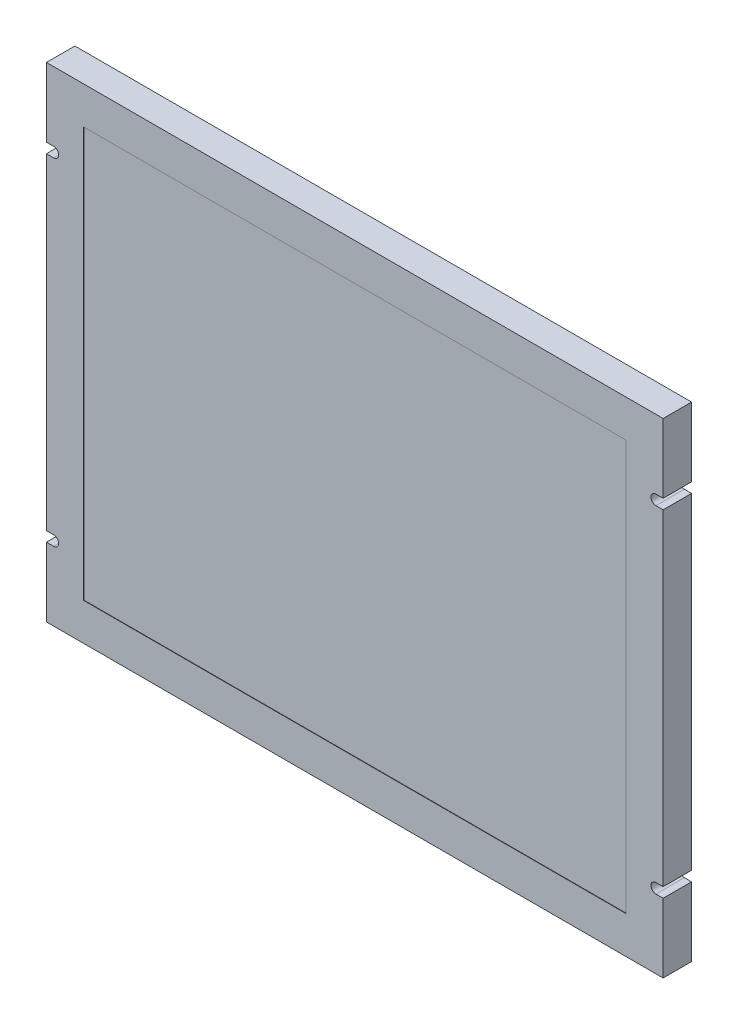
from build123d import *

# Parameters (mm, degrees)
SKETCH1_W            = 154
SKETCH1_H            = 121
EXTRUDE1_DEPTH       = 7.1
SKETCH2_W            = 135.5
SKETCH2_H            = 102.4
BEZEL_OPENING_DEPTH  = 0.1
CUT_EXTRUDE3_DEPTH   = 10
LPATTERN1_COUNT      = 2
LPATTERN1_PITCH      = 84
LPATTERN1_COUNT_DIR2 = 2
LPATTERN1_PITCH_DIR2 = 152.2


with BuildPart() as part:
    # Sketch1 → Extrude1 (new body)
    with BuildSketch(Plane.XY):
        with Locations((77, -60.5)):
            Rectangle(SKETCH1_W, SKETCH1_H)
    extrude(amount=EXTRUDE1_DEPTH)

    # Sketch2 → Bezel Opening (cut)
    with BuildSketch(Plane.XY.offset(7.1)):
        with Locations((77, -60.5)):
            Rectangle(SKETCH2_W, SKETCH2_H)
    extrude(amount=-BEZEL_OPENING_DEPTH, mode=Mode.SUBTRACT)

    # Sketch3 → Cut-Extrude3 (cut)
    with BuildSketch(Plane.XY.offset(7.1)):
        with BuildLine():
            Line((154, -17.25), (152.2, -17.25))
            ThreePointArc((152.2, -17.25), (150.95, -18.5), (152.2, -19.75))
            Line((152.2, -19.75), (154, -19.75))
            ThreePointArc((154, -19.75), (155.25, -18.5), (154, -17.25))
        make_face()
    cut_extrude3 = extrude(amount=-CUT_EXTRUDE3_DEPTH, mode=Mode.SUBTRACT)

    # LPattern1: Cut-Extrude3 2 × 2
    with Locations(*[(-j * LPATTERN1_PITCH_DIR2, -i * LPATTERN1_PITCH, 0) for i in range(LPATTERN1_COUNT) for j in range(LPATTERN1_COUNT_DIR2) if (i, j) != (0, 0)]):
        add(cut_extrude3, mode=Mode.SUBTRACT)


solid = part.part
